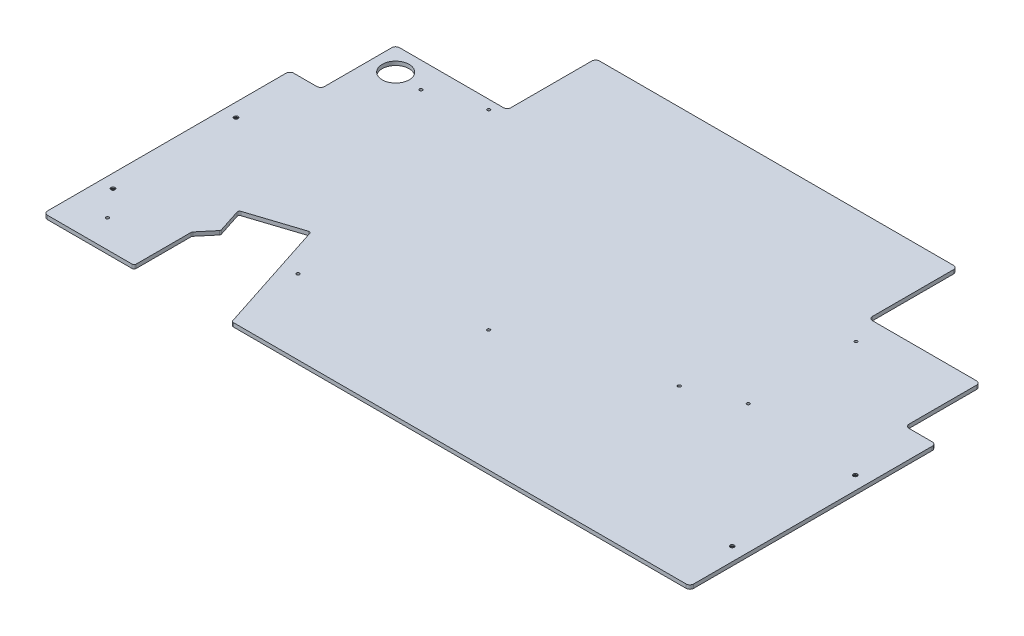
from build123d import *

# Parameters (mm, degrees)
SKETCH1_R                                     = 3.3734375
BOSS_EXTRUDE1_DEPTH                           = 6.35
SKETCH3_R                                     = 2.45745
SKETCH3_R_2                                   = 22.225
CUT_EXTRUDE2_DEPTH                            = 1264.111411604
CUT_EXTRUDE1_DEPTH                            = 1264.111411604
CSK_FOR_1_4_FLAT_HEAD_MACHINE_SCREW1_AT_COUNT = 2
CSK_FOR_1_4_FLAT_HEAD_MACHINE_SCREW1_AT_PITCH = 1022.35
CSK_FOR_1_4_FLAT_HEAD_MACHINE_SCREW1_2_COUNT  = 2
CSK_FOR_1_4_FLAT_HEAD_MACHINE_SCREW1_2_PITCH  = 203.2
CSK_FOR_1_4_FLAT_HEAD_MACHINE_SCREW1_3_COUNT  = 2
CSK_FOR_1_4_FLAT_HEAD_MACHINE_SCREW1_3_PITCH  = 1042.348196382
FILLET1_R                                     = 6.35
FILLET3_R                                     = 3.175


with BuildPart() as part:
    # Sketch1 → Boss-Extrude1 (new body)
    with BuildSketch(Plane(origin=(0, 0, 0), x_dir=(1, 0, 0), z_dir=(0, 1, 0))):
        Polygon((1016, 406.4), (1066.8, 406.4), (1066.8, 0), (0, 0), (0, 406.4), (50.8, 406.4), (50.8, 530.225), (234.95, 530.225), (234.95, 676.275), (831.85, 676.275), (831.85, 530.225), (1016, 530.225), align=None)
        with Locations(Location((22.225, 92.075, 0), (0, 0, 270))):
            Circle(SKETCH1_R, mode=Mode.SUBTRACT)
        with Locations(Location((1044.575, 92.075, 0), (0, 0, 270))):
            Circle(SKETCH1_R, mode=Mode.SUBTRACT)
        with Locations(Location((22.225, 295.275, 0), (0, 0, 270))):
            Circle(SKETCH1_R, mode=Mode.SUBTRACT)
        with Locations(Location((1044.575, 295.275, 0), (0, 0, 270))):
            Circle(SKETCH1_R, mode=Mode.SUBTRACT)
    extrude(amount=BOSS_EXTRUDE1_DEPTH)

    # Sketch3 → Cut-Extrude2 (cut, through all)
    with BuildSketch(Plane(origin=(0, 6.35, 0), x_dir=(1, 0, 0), z_dir=(0, 1, 0))):
        with Locations(Location((134.9375, 487.748914195, 0), (0, 0, 270))):
            Circle(SKETCH3_R)
        with Locations(Location((219.486424299, 515.220524995, 0), (0, 0, 270))):
            Circle(SKETCH3_R)
        with Locations(Location((59.31154, 45.87748, 0), (0, 0, 270))):
            Circle(SKETCH3_R)
        with Locations(Location((296.845703608, 123.057008284, 0), (0, 0, 270))):
            Circle(SKETCH3_R)
        with Locations(Location((534.379867216, 200.236536569, 0), (0, 0, 270))):
            Circle(SKETCH3_R)
        with Locations(Location((771.914030824, 277.416064853, 0), (0, 0, 270))):
            Circle(SKETCH3_R)
        with Locations(Location((854.075, 309.0545, 0), (0, 0, 270))):
            Circle(SKETCH3_R)
        with Locations(Location((854.075, 486.8545, 0), (0, 0, 270))):
            Circle(SKETCH3_R)
        with Locations(Location((88.9, 492.125, 0), (0, 0, 270))):
            Circle(SKETCH3_R_2)
    extrude(amount=-CUT_EXTRUDE2_DEPTH, mode=Mode.SUBTRACT)

    # Sketch2 → Cut-Extrude1 (cut, through all)
    with BuildSketch(Plane(origin=(0, 6.35, 0), x_dir=(1, 0, 0), z_dir=(0, 1, 0))):
        Polygon((310.578822168, 0), (149.225, 0), (149.225, 95.25), (171.033618902, 121.240499926), (157.061866823, 164.241131286), (247.65, 193.675), align=None)
    extrude(amount=-CUT_EXTRUDE1_DEPTH, mode=Mode.SUBTRACT)

    # Sketch5 → CSK for 1/4 Flat Head Machine Screw1 (revolve, cut)
    with BuildSketch(Plane(origin=(22.225, 0, -92.075), x_dir=(0, 0, -1), z_dir=(1, 0, 0))):
        Polygon((0, 0), (0, 6.35), (3.3782, 6.35), (3.3782, 4.536932584), (6.4389, 1.016), (6.4389, 0), align=None)
    csk_for_1_4_flat_head_machine_screw1 = revolve(axis=Axis((22.225, -6.35, -92.075), (0, 1, 0)), mode=Mode.SUBTRACT)

    # CSK for 1/4 Flat Head Machine Screw1 at: CSK for 1/4 Flat Head Machine Screw1 ×2
    with Locations(*[(i * CSK_FOR_1_4_FLAT_HEAD_MACHINE_SCREW1_AT_PITCH, 0, 0) for i in range(1, CSK_FOR_1_4_FLAT_HEAD_MACHINE_SCREW1_AT_COUNT)]):
        add(csk_for_1_4_flat_head_machine_screw1, mode=Mode.SUBTRACT)

    # CSK for 1_4 Flat Head Machine Screw1 2: CSK for 1/4 Flat Head Machine Screw1 ×2
    with Locations(*[(0, 0, -i * CSK_FOR_1_4_FLAT_HEAD_MACHINE_SCREW1_2_PITCH) for i in range(1, CSK_FOR_1_4_FLAT_HEAD_MACHINE_SCREW1_2_COUNT)]):
        add(csk_for_1_4_flat_head_machine_screw1, mode=Mode.SUBTRACT)

    # CSK for 1_4 Flat Head Machine Screw1 3: CSK for 1/4 Flat Head Machine Screw1 ×2
    with Locations(*[Vector(0.9808142840837317, 0, -0.19494445397937524) * (i * CSK_FOR_1_4_FLAT_HEAD_MACHINE_SCREW1_3_PITCH) for i in range(1, CSK_FOR_1_4_FLAT_HEAD_MACHINE_SCREW1_3_COUNT)]):
        add(csk_for_1_4_flat_head_machine_screw1, mode=Mode.SUBTRACT)

    # Fillet1
    fillet1_edges = [part.edges().sort_by_distance(p)[0] for p in [
        (0, 3.175, -406.4),
        (50.8, 3.175, -406.4),
        (50.8, 3.175, -530.225),
        (234.95, 3.175, -530.225),
        (234.95, 3.175, -676.275),
        (831.85, 3.175, -676.275),
        (831.85, 3.175, -530.225),
        (1016, 3.175, -530.225),
        (1016, 3.175, -406.4),
        (1066.8, 3.175, -406.4),
        (1066.8, 3.175, 0),
        (0, 3.175, 0),
    ]]
    fillet(fillet1_edges, radius=FILLET1_R)

    # Fillet3
    fillet3_edges = [part.edges().sort_by_distance(p)[0] for p in [
        (247.65, 3.175, -193.675),
        (310.578822168, 3.175, 0),
        (149.225, 3.175, 0),
        (149.225, 3.175, -95.25),
        (171.033618902, 3.175, -121.240499926),
        (157.061866823, 3.175, -164.241131286),
    ]]
    fillet(fillet3_edges, radius=FILLET3_R)


solid = part.part
